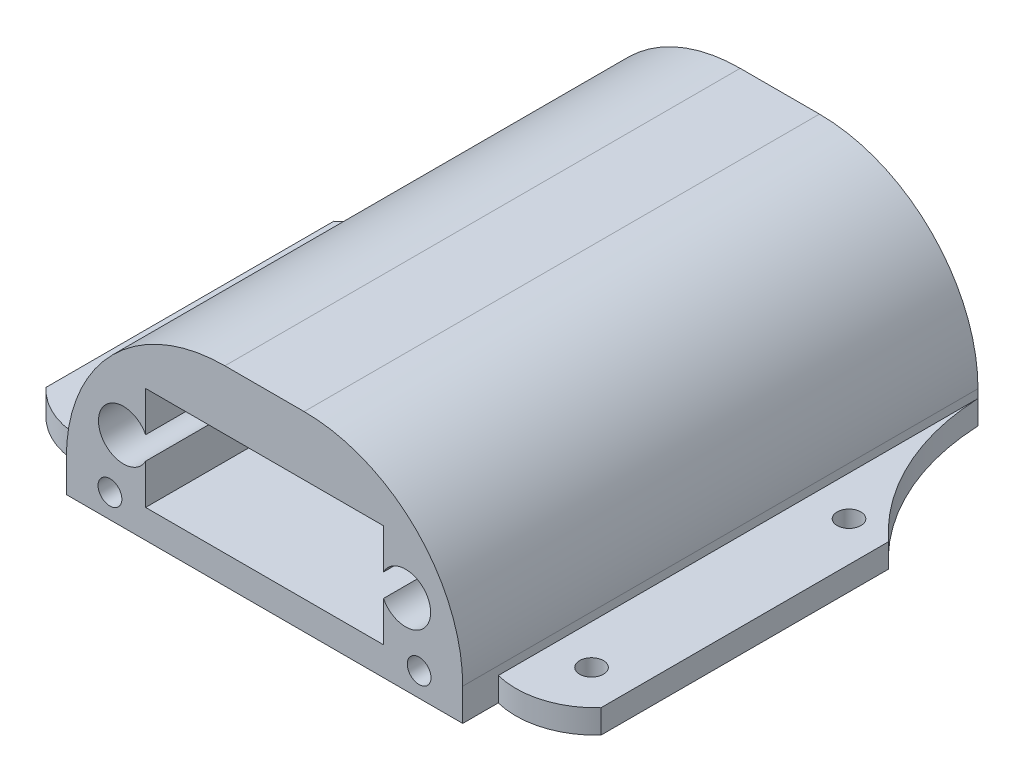
from build123d import *

# Parameters (mm, degrees)
SKETCH1_W           = 30
SKETCH1_H           = 13
BOSS_EXTRUDE2_DEPTH = 3
BOSS_EXTRUDE3_DEPTH = 65
SKETCH5_R           = 1.5
CUT_EXTRUDE3_DEPTH  = 13
SKETCH6_R           = 1.5
BOSS_EXTRUDE4_DEPTH = 3
SKETCH7_W           = 5.6
SKETCH7_H           = 3.1
CUT_EXTRUDE4_DEPTH  = 6


with BuildPart() as part:
    # Sketch1 → Boss-Extrude2 (new body)
    with BuildSketch(Plane.XY):
        with BuildLine():
            Line((0, 4.071593084), (0, 0))
            Line((0, 0), (50, 0))
            Line((50, 0), (50, 4.071593084))
            ThreePointArc((50, 4.071593084), (44.142135624, 18.213728707), (30, 24.071593084))
            Line((30, 24.071593084), (20, 24.071593084))
            ThreePointArc((20, 24.071593084), (5.857864376, 18.213728707), (0, 4.071593084))
        make_face()
        with Locations((25, 10.1)):
            Rectangle(SKETCH1_W, SKETCH1_H, mode=Mode.SUBTRACT)
    extrude(amount=BOSS_EXTRUDE2_DEPTH)

    # Sketch1<4> → Boss-Extrude3 (add)
    with BuildSketch(Plane.XY):
        with BuildLine():
            Line((0, 4.071593084), (0, 0))
            Line((0, 0), (50, 0))
            Line((50, 0), (50, 4.071593084))
            ThreePointArc((50, 4.071593084), (44.142135624, 18.213728707), (30, 24.071593084))
            Line((30, 24.071593084), (20, 24.071593084))
            ThreePointArc((20, 24.071593084), (5.857864376, 18.213728707), (0, 4.071593084))
        make_face()
        with BuildLine():
            Line((10, 11.543086969), (10, 16.6))
            Line((10, 16.6), (40, 16.6))
            Line((40, 16.6), (40, 11.543086969))
            ThreePointArc((40, 11.543086969), (45.95, 10.1), (40, 8.656913031))
            Line((40, 8.656913031), (40, 3.6))
            Line((40, 3.6), (25, 3.6))
            Line((25, 3.6), (10, 3.6))
            Line((10, 3.6), (10, 8.656913031))
            ThreePointArc((10, 8.656913031), (4.05, 10.1), (10, 11.543086969))
        make_face(mode=Mode.SUBTRACT)
    extrude(amount=BOSS_EXTRUDE3_DEPTH)

    # Sketch5 → Cut-Extrude3 (cut)
    with BuildSketch(Plane.XY.offset(65)):
        with Locations((5.5, 3)):
            Circle(SKETCH5_R)
        with Locations((44.5, 3)):
            Circle(SKETCH5_R)
    extrude(amount=-CUT_EXTRUDE3_DEPTH, mode=Mode.SUBTRACT)

    # Sketch6 → Boss-Extrude4 (add)
    # profile 1 of 2: a face of its own
    with BuildSketch(Plane(origin=(0, 0, 0), x_dir=(-1, 0, 0), z_dir=(0, -1, 0))):
        with BuildLine():
            Line((-60, -21.270803163), (-60, -57.567716257))
            ThreePointArc((-60, -57.567716257), (-55.406345217, -60.42004806), (-50, -60.514347456))
            Line((-50, -60.514347456), (-50, 0))
            ThreePointArc((-50, 0), (-52.87596668, -11.633969103), (-60, -21.270803163))
        make_face()
        with Locations((-55, -53.75)):
            Circle(SKETCH6_R, mode=Mode.SUBTRACT)
        with Locations((-55, -21.270803163)):
            Circle(SKETCH6_R, mode=Mode.SUBTRACT)
    # profile 2 of 2: a face of its own
    with BuildSketch(Plane(origin=(0, 0, 0), x_dir=(-1, 0, 0), z_dir=(0, -1, 0))):
        with BuildLine():
            Line((0, -60.514347456), (0, 0))
            ThreePointArc((0, 0), (2.87596668, -11.633969103), (10, -21.270803163))
            Line((10, -21.270803163), (10, -57.567716257))
            ThreePointArc((10, -57.567716257), (5.406345217, -60.42004806), (0, -60.514347456))
        make_face()
        with Locations((5, -21.270803163)):
            Circle(SKETCH6_R, mode=Mode.SUBTRACT)
        with Locations((5, -53.75)):
            Circle(SKETCH6_R, mode=Mode.SUBTRACT)
    extrude(amount=-BOSS_EXTRUDE4_DEPTH)

    # Sketch7 → Cut-Extrude4 (cut)
    with BuildSketch(Plane.XZ):
        with Locations((44.5, 60)):
            Rectangle(SKETCH7_W, SKETCH7_H)
        with Locations((5.5, 60)):
            Rectangle(SKETCH7_W, SKETCH7_H)
    extrude(amount=-CUT_EXTRUDE4_DEPTH, mode=Mode.SUBTRACT)


solid = part.part
